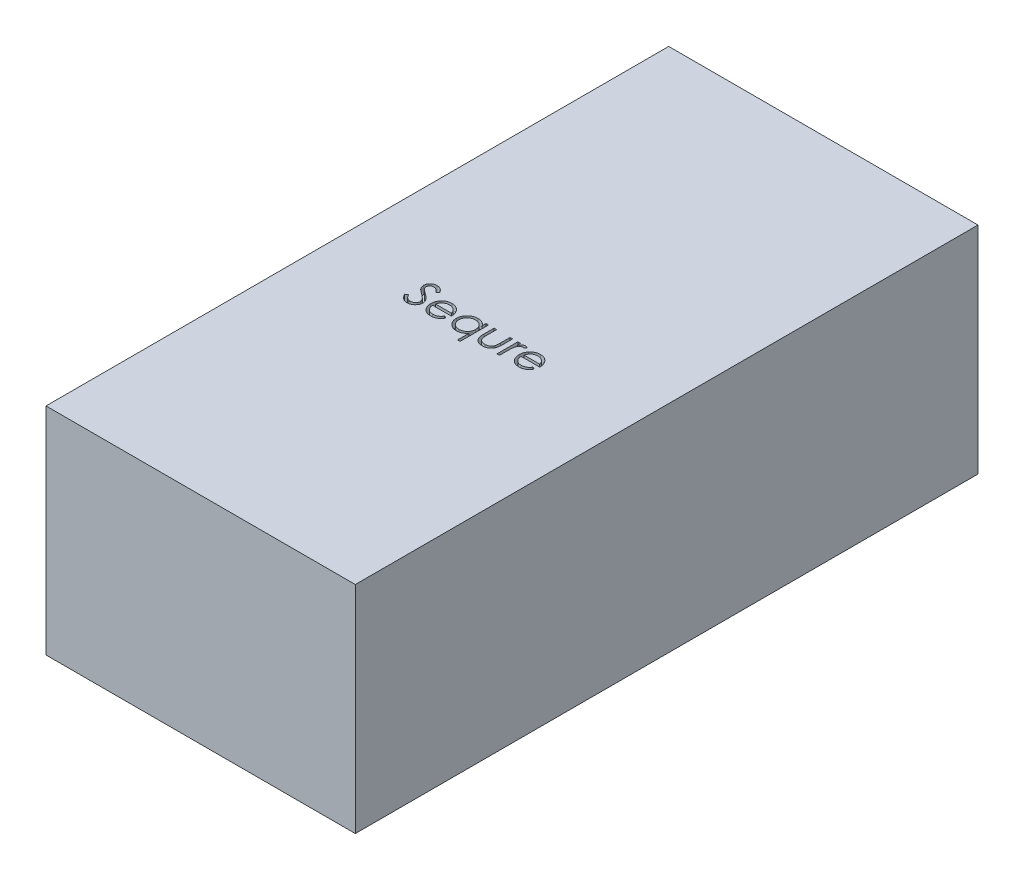
from build123d import *

# Parameters (mm, degrees)
SKETCH1_W           = 38
SKETCH1_H           = 76.5
BOSS_EXTRUDE1_DEPTH = 26.5
CUT_EXTRUDE1_DEPTH  = 1


with BuildPart() as part:
    # Sketch1 → Boss-Extrude1 (new body)
    with BuildSketch(Plane(origin=(0, 0, 0), x_dir=(1, 0, 0), z_dir=(0, 1, 0))):
        with Locations((19, 38.25)):
            Rectangle(SKETCH1_W, SKETCH1_H)
    extrude(amount=BOSS_EXTRUDE1_DEPTH)

    # Sketch2 → Cut-Extrude1 (cut)
    # profile 1 of 6: a face of its own
    with BuildSketch(Plane(origin=(0, 26.5, 0), x_dir=(1, 0, 0), z_dir=(0, 1, 0))):
        with BuildLine():
            Line((10.136770762, 33.919409506), (10.43264416, 34.09679332))
            add(Edge.make_bspline(
                [(10.43264416, 34.09679332), (10.460162397, 34.050728935), (10.512886278, 33.962471351), (10.600837637, 33.84321331), (10.691970548, 33.741851154), (10.786959881, 33.658974546), (10.885225829, 33.593725659), (10.987409883, 33.547523428), (11.093167694, 33.518707452), (11.165141515, 33.515207366), (11.201073647, 33.513459986)],
                knots=[0, 0, 0, 0, 1.272034388, 2.437168799, 3.508375237, 4.49857839, 5.41946034, 6.295179144, 7.148887113, 8, 8, 8, 8], degree=3))
            add(Edge.make_bspline(
                [(11.201073647, 33.513459986), (11.231760507, 33.514314659), (11.29259728, 33.516009049), (11.382159523, 33.532289851), (11.469141326, 33.55730198), (11.551749963, 33.593122912), (11.628845578, 33.636461397), (11.696452273, 33.688807575), (11.754898386, 33.747413781), (11.802707501, 33.812796435), (11.839387536, 33.883113584), (11.867579605, 33.955289535), (11.883224678, 34.030458103), (11.885581432, 34.081068566), (11.886770762, 34.106609025)],
                knots=[0, 0, 0, 0, 1.095163259, 2.171163733, 3.241058638, 4.321873601, 5.38011039, 6.391990106, 7.366004449, 8.327778327, 9.272591725, 10.192022065, 11.087607919, 12, 12, 12, 12], degree=3))
            add(Edge.make_bspline(
                [(11.886770762, 34.106609025), (11.885296451, 34.135749875), (11.882299393, 34.194988964), (11.856967913, 34.282388617), (11.817118666, 34.368881187), (11.780356023, 34.422382452), (11.761269961, 34.450158704)],
                knots=[0, 0, 0, 0, 0.938893495, 1.908633276, 2.914225137, 4, 4, 4, 4], degree=3))
            add(Edge.make_bspline(
                [(11.761269961, 34.450158704), (11.745599347, 34.470205528), (11.712700852, 34.512291326), (11.65614334, 34.574936562), (11.589777226, 34.639554981), (11.515873671, 34.708614038), (11.431740582, 34.778901835), (11.340013067, 34.853770112), (11.238349208, 34.93037169), (11.167049712, 34.981744255), (11.130260346, 35.008251653)],
                knots=[0, 0, 0, 0, 0.722233717, 1.516239348, 2.393582979, 3.351407094, 4.387010283, 5.505090956, 6.712668013, 8, 8, 8, 8], degree=3))
            add(Edge.make_bspline(
                [(11.130260346, 35.008251653), (11.093436349, 35.034480241), (11.023031673, 35.084627303), (10.92457309, 35.159051587), (10.836528627, 35.227095456), (10.759289611, 35.289399469), (10.692890014, 35.345972073), (10.636806603, 35.396270012), (10.592468046, 35.441653573), (10.567812465, 35.471094915), (10.556742717, 35.484313352)],
                knots=[0, 0, 0, 0, 1.452282411, 2.77665338, 3.964542531, 5.026858415, 5.96415736, 6.766646006, 7.446254459, 8, 8, 8, 8], degree=3))
            add(Edge.make_bspline(
                [(10.556742717, 35.484313352), (10.541270172, 35.504914389), (10.510841335, 35.545429092), (10.47067533, 35.60875395), (10.436536167, 35.673577216), (10.409773835, 35.74007308), (10.387237616, 35.807308009), (10.372079685, 35.876159255), (10.362588289, 35.946317873), (10.361616302, 35.993531374), (10.361129737, 36.017165916)],
                knots=[0, 0, 0, 0, 1.068054152, 2.10047183, 3.106115577, 4.101338837, 5.06977816, 6.043150881, 7.020423561, 8, 8, 8, 8], degree=3))
            add(Edge.make_bspline(
                [(10.361129737, 36.017165916), (10.362434946, 36.05419569), (10.365017466, 36.127463754), (10.386857983, 36.234494585), (10.421330877, 36.336681002), (10.469625764, 36.433011336), (10.531883117, 36.520977316), (10.603929092, 36.601590803), (10.689740578, 36.669359386), (10.783893201, 36.728571444), (10.886949573, 36.774917369), (10.994940477, 36.809878349), (11.108037549, 36.829687607), (11.184640683, 36.832530372), (11.223509544, 36.833972807)],
                knots=[0, 0, 0, 0, 1.005424448, 1.989358655, 2.955360095, 3.929531133, 4.905563448, 5.876582895, 6.856512386, 7.866279853, 8.892233794, 9.918561126, 10.94386622, 12, 12, 12, 12], degree=3))
            add(Edge.make_bspline(
                [(11.223509544, 36.833972807), (11.264753645, 36.832550255), (11.346774996, 36.829721254), (11.467424212, 36.805123723), (11.583584928, 36.764423051), (11.677028193, 36.718234393), (11.750160955, 36.672102977), (11.805933687, 36.630083153), (11.862451138, 36.581708044), (11.920169193, 36.526848798), (11.978109852, 36.465002047), (12.037133305, 36.396591358), (12.097377573, 36.322034803), (12.136133433, 36.268810302), (12.156001531, 36.24152489)],
                knots=[0, 0, 0, 0, 1.286793592, 2.559021753, 3.825965368, 5.121522368, 5.803751409, 6.523245864, 7.299691795, 8.125521123, 9.008227632, 9.944561021, 10.946284179, 12, 12, 12, 12], degree=3))
            Line((12.156001531, 36.24152489), (11.872047205, 36.026280499))
            add(Edge.make_bspline(
                [(11.872047205, 36.026280499), (11.854901272, 36.04836919), (11.821882215, 36.090906843), (11.771752728, 36.150478158), (11.72450408, 36.204894638), (11.67795368, 36.252159766), (11.634560049, 36.294861899), (11.592443007, 36.331421656), (11.552208655, 36.362197252), (11.501491745, 36.395040812), (11.437774026, 36.427597315), (11.35778949, 36.455146393), (11.274203215, 36.471701455), (11.217273584, 36.473890343), (11.188453455, 36.474998448)],
                knots=[0, 0, 0, 0, 1.181633172, 2.275549214, 3.290209073, 4.226197932, 5.078386478, 5.862611352, 6.581680152, 7.217281963, 8.414376989, 9.595101626, 10.782541182, 12, 12, 12, 12], degree=3))
            add(Edge.make_bspline(
                [(11.188453455, 36.474998448), (11.152296932, 36.473786748), (11.082572485, 36.471450099), (10.983582249, 36.445930113), (10.894488324, 36.405748253), (10.817935758, 36.349433275), (10.754198781, 36.282712282), (10.708093323, 36.205933427), (10.680343158, 36.121151025), (10.676956878, 36.062009368), (10.675232301, 36.031889474)],
                knots=[0, 0, 0, 0, 1.14458467, 2.207223713, 3.21896685, 4.227309161, 5.202851033, 6.127160689, 7.046193047, 8, 8, 8, 8], degree=3))
            add(Edge.make_bspline(
                [(10.675232301, 36.031889474), (10.675625427, 36.013137995), (10.676412323, 35.975604376), (10.687387121, 35.920152954), (10.70148645, 35.864841614), (10.723829082, 35.809919031), (10.754674385, 35.754424672), (10.795179561, 35.697402935), (10.846192873, 35.638351226), (10.885269886, 35.599943852), (10.905901371, 35.579665916)],
                knots=[0, 0, 0, 0, 0.858281714, 1.717966888, 2.583508476, 3.4729293, 4.427298488, 5.488583878, 6.674047936, 8, 8, 8, 8], degree=3))
            add(Edge.make_bspline(
                [(10.905901371, 35.579665916), (10.913562744, 35.57282889), (10.931764411, 35.556585682), (10.965040336, 35.529993401), (11.008983135, 35.497190629), (11.062445336, 35.456603312), (11.126412698, 35.40952185), (11.200892254, 35.356548238), (11.285053787, 35.295962779), (11.344775702, 35.253605238), (11.376354096, 35.231208384)],
                knots=[0, 0, 0, 0, 0.420754252, 0.999615792, 1.744751191, 2.668019286, 3.750313428, 4.999500688, 6.413464383, 8, 8, 8, 8], degree=3))
            add(Edge.make_bspline(
                [(11.376354096, 35.231208384), (11.414340009, 35.203567024), (11.487894465, 35.150043362), (11.592552045, 35.069627682), (11.687445853, 34.990979914), (11.772909057, 34.914602307), (11.849785965, 34.841074214), (11.917223686, 34.769511033), (11.975909366, 34.700425461), (12.039088585, 34.611852885), (12.103646404, 34.503071801), (12.159087912, 34.369793562), (12.194046259, 34.235997242), (12.198617775, 34.146070405), (12.200873326, 34.101701172)],
                knots=[0, 0, 0, 0, 1.163667725, 2.253281268, 3.268753668, 4.215851969, 5.092017293, 5.902905408, 6.650798638, 7.335211899, 8.59617414, 9.77448103, 10.901945474, 12, 12, 12, 12], degree=3))
            add(Edge.make_bspline(
                [(12.200873326, 34.101701172), (12.200216188, 34.070322807), (12.198914673, 34.008175424), (12.183953759, 33.916920347), (12.162034094, 33.828289477), (12.12899686, 33.743378365), (12.088673702, 33.660633602), (12.037507454, 33.582225701), (11.978199769, 33.506419303), (11.910166004, 33.435235812), (11.835720102, 33.369889616), (11.757036407, 33.311760554), (11.673986135, 33.263292231), (11.587019818, 33.223741389), (11.496117481, 33.192807871), (11.401309697, 33.170395002), (11.302440186, 33.156639291), (11.235239705, 33.15521153), (11.201073647, 33.154485627)],
                knots=[0, 0, 0, 0, 0.983748083, 1.948392443, 2.894712957, 3.844097841, 4.80183111, 5.778335162, 6.776009319, 7.81870978, 8.863265674, 9.881300176, 10.883814829, 11.87499822, 12.874611388, 13.892143829, 14.928324115, 16, 16, 16, 16], degree=3))
            add(Edge.make_bspline(
                [(11.201073647, 33.154485627), (11.174638304, 33.154996809), (11.122100544, 33.156012734), (11.044391062, 33.164994015), (10.968251473, 33.177701118), (10.894637191, 33.197875188), (10.822599779, 33.222352165), (10.752452545, 33.252490498), (10.684161491, 33.288607699), (10.617343908, 33.329902724), (10.552169733, 33.377960469), (10.489250265, 33.433933965), (10.42652108, 33.49627947), (10.365833683, 33.566690033), (10.305960539, 33.644028116), (10.24808213, 33.7290173), (10.191000412, 33.821194653), (10.155184944, 33.886059739), (10.136770762, 33.919409506)],
                knots=[0, 0, 0, 0, 0.915332311, 1.819136955, 2.706846663, 3.586547465, 4.459518054, 5.340707479, 6.227863349, 7.133153174, 8.059268498, 9.028702269, 10.047606654, 11.120612155, 12.245963614, 13.433783089, 14.680604001, 16, 16, 16, 16], degree=3))
        make_face()
    # profile 2 of 6: a face of its own
    with BuildSketch(Plane(origin=(0, 26.5, 0), x_dir=(1, 0, 0), z_dir=(0, 1, 0))):
        with BuildLine():
            Line((14.928237108, 34.051921525), (15.207283583, 33.90538707))
            add(Edge.make_bspline(
                [(15.207283583, 33.90538707), (15.185046987, 33.865943738), (15.141783379, 33.789202636), (15.067382631, 33.683770775), (14.989390559, 33.588923059), (14.904286591, 33.507193405), (14.814616912, 33.43594202), (14.719884257, 33.373604195), (14.619595439, 33.320485675), (14.513745714, 33.275733147), (14.401446163, 33.241323653), (14.282424647, 33.217019432), (14.156453151, 33.201996163), (14.070106971, 33.200251023), (14.025893358, 33.199357422)],
                knots=[0, 0, 0, 0, 1.120438281, 2.179929193, 3.190490725, 4.156257408, 5.095198341, 6.022838206, 6.959905092, 7.901321166, 8.864066838, 9.862729781, 10.905609505, 12, 12, 12, 12], degree=3))
            add(Edge.make_bspline(
                [(14.025893358, 33.199357422), (13.976751381, 33.200504598), (13.880889619, 33.202742404), (13.741349872, 33.222034869), (13.609970454, 33.253507227), (13.48675875, 33.297472769), (13.372016498, 33.354900093), (13.265515643, 33.424859575), (13.166696117, 33.506991829), (13.078671908, 33.602008273), (12.999428025, 33.70369023), (12.929502205, 33.809646115), (12.871044774, 33.919609339), (12.823492164, 34.032879863), (12.785087299, 34.148743757), (12.758320595, 34.268255224), (12.742890847, 34.391090809), (12.740526402, 34.474188144), (12.739334865, 34.516064153)],
                knots=[0, 0, 0, 0, 1.145258523, 2.234067595, 3.276747158, 4.290159414, 5.277019952, 6.260822364, 7.254936242, 8.264827045, 9.274100331, 10.257902744, 11.220704747, 12.172965371, 13.118907548, 14.062713208, 15.023725156, 16, 16, 16, 16], degree=3))
            add(Edge.make_bspline(
                [(12.739334865, 34.516064153), (12.740394006, 34.555358983), (12.742493084, 34.633236148), (12.755723872, 34.748501693), (12.779172165, 34.860530145), (12.811348489, 34.969414593), (12.852899735, 35.074972727), (12.903731954, 35.177268791), (12.963924332, 35.276193931), (13.010397006, 35.338597064), (13.033806019, 35.370030499)],
                knots=[0, 0, 0, 0, 1.024358464, 2.0301432, 3.019427413, 4.004406732, 4.986367066, 5.972626655, 6.978780325, 8, 8, 8, 8], degree=3))
            add(Edge.make_bspline(
                [(13.033806019, 35.370030499), (13.065513701, 35.407899369), (13.127924648, 35.48243752), (13.233481003, 35.580375845), (13.3477812, 35.662419621), (13.469392826, 35.730426757), (13.5997293, 35.782100404), (13.737038591, 35.820607986), (13.882884177, 35.842185997), (13.982589398, 35.845233831), (14.033605698, 35.84679332)],
                knots=[0, 0, 0, 0, 1.030682036, 2.02871468, 2.997146059, 3.962720338, 4.930598197, 5.918074684, 6.934738563, 8, 8, 8, 8], degree=3))
            add(Edge.make_bspline(
                [(14.033605698, 35.84679332), (14.086053303, 35.845439271), (14.188943549, 35.842782936), (14.33897567, 35.818156602), (14.480936387, 35.779104048), (14.614768891, 35.723950257), (14.740486752, 35.652790705), (14.857272802, 35.564648864), (14.967124314, 35.462230777), (15.031032893, 35.383467567), (15.063553615, 35.343387871)],
                knots=[0, 0, 0, 0, 1.056321875, 2.072262726, 3.055038591, 4.01806755, 4.982017516, 5.957941055, 6.960871419, 8, 8, 8, 8], degree=3))
            add(Edge.make_bspline(
                [(15.063553615, 35.343387871), (15.085680553, 35.31318429), (15.129787146, 35.252978171), (15.185034246, 35.154807014), (15.232991641, 35.052096419), (15.271324602, 34.943186122), (15.302364103, 34.829366542), (15.324820922, 34.709823997), (15.337990541, 34.584594086), (15.340579238, 34.499267531), (15.341898967, 34.455767679)],
                knots=[0, 0, 0, 0, 0.94817472, 1.890038105, 2.849395472, 3.817997239, 4.812318967, 5.836947057, 6.897266129, 8, 8, 8, 8], degree=3))
            Line((15.341898967, 34.455767679), (13.053437429, 34.455767679))
            add(Edge.make_bspline(
                [(13.053437429, 34.455767679), (13.054977035, 34.422067214), (13.058004609, 34.355796611), (13.072119752, 34.258825828), (13.094368526, 34.166452485), (13.125637589, 34.079369443), (13.163504434, 33.996439316), (13.209890151, 33.918277279), (13.265229705, 33.845239349), (13.326955404, 33.776672211), (13.3956625, 33.71561145), (13.467945247, 33.660959674), (13.544838812, 33.615154077), (13.625736895, 33.577974187), (13.71050868, 33.548867871), (13.799180875, 33.529000051), (13.891578992, 33.515692944), (13.954564726, 33.514213279), (13.986630538, 33.513459986)],
                knots=[0, 0, 0, 0, 1.094153842, 2.151609401, 3.174256925, 4.172055639, 5.149267565, 6.128595816, 7.11444997, 8.118368179, 9.117203808, 10.09244225, 11.054858984, 12.015122123, 12.976791628, 13.957293641, 14.960065497, 16, 16, 16, 16], degree=3))
            add(Edge.make_bspline(
                [(13.986630538, 33.513459986), (14.017981685, 33.514068043), (14.080188376, 33.515274544), (14.172829234, 33.527006455), (14.263968761, 33.545976731), (14.353229744, 33.571866721), (14.43880059, 33.603443573), (14.51804614, 33.64154643), (14.590926356, 33.683696177), (14.659043323, 33.731905852), (14.725114316, 33.790914039), (14.790656802, 33.86454976), (14.860933456, 33.951637288), (14.904923048, 34.017182954), (14.928237108, 34.051921525)],
                knots=[0, 0, 0, 0, 0.99110716, 1.966546729, 2.947904876, 3.932708344, 4.903319531, 5.828989031, 6.710028674, 7.56322171, 8.463672341, 9.504779593, 10.677557249, 12, 12, 12, 12], degree=3))
        make_face()
        with BuildLine():
            add(Edge.make_bspline(
                [(15.027796403, 34.769870243), (15.016299779, 34.811533116), (14.994172477, 34.891720737), (14.947936113, 35.002761627), (14.895864572, 35.101449529), (14.834242841, 35.187029162), (14.764424115, 35.263032675), (14.683778932, 35.32945126), (14.593343039, 35.388868711), (14.493583898, 35.43902121), (14.387942113, 35.481711069), (14.277335921, 35.510336185), (14.164478133, 35.529945727), (14.088143847, 35.531771835), (14.049731499, 35.532690756)],
                knots=[0, 0, 0, 0, 1.154881502, 2.222775134, 3.210006277, 4.132804581, 5.035138423, 5.962687519, 6.919655026, 7.923214229, 8.944639381, 9.960483929, 10.97369054, 12, 12, 12, 12], degree=3))
            add(Edge.make_bspline(
                [(14.049731499, 35.532690756), (14.018382061, 35.532079084), (13.956410812, 35.530869938), (13.865109744, 35.519399809), (13.777430045, 35.500439964), (13.692724757, 35.474475007), (13.612103889, 35.439866405), (13.53390912, 35.399283178), (13.460128724, 35.349741594), (13.413987429, 35.311982739), (13.390677012, 35.292907102)],
                knots=[0, 0, 0, 0, 1.04873581, 2.073130211, 3.073294108, 4.04793562, 5.032784715, 6.005352987, 6.992311501, 8, 8, 8, 8], degree=3))
            add(Edge.make_bspline(
                [(13.390677012, 35.292907102), (13.37398373, 35.277812786), (13.340200596, 35.24726557), (13.295060075, 35.194636363), (13.251839602, 35.137884801), (13.212505949, 35.074839677), (13.176428363, 35.006218898), (13.142668385, 34.932601262), (13.112281973, 34.853428132), (13.095185863, 34.798255693), (13.086390153, 34.769870243)],
                knots=[0, 0, 0, 0, 0.879870761, 1.780643979, 2.707998968, 3.669668524, 4.684282772, 5.740141944, 6.837334558, 8, 8, 8, 8], degree=3))
            Line((13.086390153, 34.769870243), (15.027796403, 34.769870243))
        make_face(mode=Mode.SUBTRACT)
    # profile 3 of 6: a face of its own
    with BuildSketch(Plane(origin=(0, 26.5, 0), x_dir=(1, 0, 0), z_dir=(0, 1, 0))):
        with BuildLine():
            Line((18.572668198, 35.801921525), (18.572668198, 32.301921525))
            Line((18.572668198, 32.301921525), (18.258565634, 32.301921525))
            Line((18.258565634, 32.301921525), (18.258565634, 33.707670724))
            add(Edge.make_bspline(
                [(18.258565634, 33.707670724), (18.223095564, 33.667451456), (18.153674588, 33.588735492), (18.038304491, 33.484713633), (17.916226564, 33.396811022), (17.787533526, 33.324727284), (17.653206558, 33.267844215), (17.511915761, 33.229135283), (17.365121867, 33.20320829), (17.264721993, 33.200651704), (17.21389416, 33.199357422)],
                knots=[0, 0, 0, 0, 1.069893489, 2.093963999, 3.093541679, 4.066938296, 5.033073547, 5.99758523, 6.986269586, 8, 8, 8, 8], degree=3))
            add(Edge.make_bspline(
                [(17.21389416, 33.199357422), (17.168726206, 33.200583795), (17.079653001, 33.203002255), (16.948623924, 33.221764559), (16.822531674, 33.25189518), (16.701257102, 33.29379607), (16.585584956, 33.349376891), (16.47452486, 33.415918139), (16.368652168, 33.495158969), (16.269580629, 33.585746998), (16.178348628, 33.684141985), (16.098287356, 33.789087532), (16.031534276, 33.900129836), (15.975714195, 34.01586299), (15.932717851, 34.137177909), (15.902744216, 34.263655077), (15.88400377, 34.395144951), (15.881586309, 34.484684474), (15.880360506, 34.530086589)],
                knots=[0, 0, 0, 0, 1.033919861, 2.038935746, 3.024066025, 3.998881131, 4.97069526, 5.957263378, 6.95902576, 7.993208707, 9.027059324, 10.027763471, 11.009749337, 11.988697705, 12.965288445, 13.950418724, 14.960734635, 16, 16, 16, 16], degree=3))
            add(Edge.make_bspline(
                [(15.880360506, 34.530086589), (15.881613477, 34.574550292), (15.884090534, 34.662452636), (15.902543754, 34.791731334), (15.933574763, 34.916249595), (15.97712261, 35.035606538), (16.032964565, 35.149946588), (16.100892652, 35.259350613), (16.180911777, 35.36412001), (16.273164184, 35.461791237), (16.373098954, 35.552011851), (16.480007685, 35.630420897), (16.591230966, 35.698137746), (16.708493977, 35.751791222), (16.830061082, 35.795200327), (16.957014527, 35.825233295), (17.088826106, 35.842930616), (17.178316598, 35.84549338), (17.223709865, 35.84679332)],
                knots=[0, 0, 0, 0, 1.020392517, 2.01726096, 2.990465484, 3.961182959, 4.928053699, 5.906110375, 6.912531644, 7.948652711, 8.985773172, 9.998621852, 10.987621588, 11.969261332, 12.953316658, 13.946091881, 14.958173133, 16, 16, 16, 16], degree=3))
            add(Edge.make_bspline(
                [(17.223709865, 35.84679332), (17.275909724, 35.845355568), (17.378271184, 35.842536205), (17.527999193, 35.819073478), (17.669643671, 35.779435011), (17.804298023, 35.725517513), (17.931478709, 35.653868784), (18.049981693, 35.563488823), (18.161047177, 35.454947636), (18.225427468, 35.371577191), (18.258565634, 35.328664313)],
                knots=[0, 0, 0, 0, 1.038897134, 2.037228247, 3.008116434, 3.962042015, 4.918381754, 5.904844433, 6.921570401, 8, 8, 8, 8], degree=3))
            Line((18.258565634, 35.328664313), (18.258565634, 35.801921525))
            Line((18.258565634, 35.801921525), (18.572668198, 35.801921525))
        make_face()
        with BuildLine():
            add(Edge.make_bspline(
                [(17.227916596, 35.532690756), (17.182002258, 35.531057118), (17.091374658, 35.527832577), (16.958330656, 35.502659082), (16.831017242, 35.460774487), (16.710071167, 35.403492586), (16.597402951, 35.331463849), (16.49670928, 35.244342466), (16.407166578, 35.144505452), (16.331858314, 35.032403342), (16.270467817, 34.912225251), (16.227300785, 34.786600812), (16.198831538, 34.657795835), (16.195923017, 34.570433149), (16.19446307, 34.52658098)],
                knots=[0, 0, 0, 0, 1.031046209, 2.035121221, 3.029706178, 4.034933723, 5.034054252, 6.02443088, 7.017295772, 8.038157696, 9.050218397, 10.03989886, 11.016116709, 12, 12, 12, 12], degree=3))
            add(Edge.make_bspline(
                [(16.19446307, 34.52658098), (16.196327963, 34.482990873), (16.20005044, 34.395981517), (16.226801134, 34.26700094), (16.271681008, 34.141346898), (16.332923071, 34.020085905), (16.409609695, 33.907501804), (16.498498348, 33.805761682), (16.600448629, 33.718272093), (16.713376136, 33.64503452), (16.833984107, 33.585871999), (16.960818038, 33.544706359), (17.091493676, 33.518128579), (17.18034601, 33.515024102), (17.225112108, 33.513459986)],
                knots=[0, 0, 0, 0, 0.979072187, 1.954306742, 2.945804271, 3.96968567, 4.997920485, 5.998718438, 6.996577872, 8.005894225, 9.015743152, 10.005417472, 10.995077863, 12, 12, 12, 12], degree=3))
            add(Edge.make_bspline(
                [(17.225112108, 33.513459986), (17.270558611, 33.51511995), (17.360947198, 33.518421454), (17.494385906, 33.543702719), (17.623880868, 33.585471518), (17.747668097, 33.643370644), (17.862984228, 33.715128), (17.966482105, 33.799135091), (18.053998074, 33.896838275), (18.128190683, 34.004214728), (18.1863661, 34.121926725), (18.228742159, 34.247260916), (18.253796065, 34.380221664), (18.256953795, 34.471085591), (18.258565634, 34.517466397)],
                knots=[0, 0, 0, 0, 1.01762866, 2.023962475, 3.030623092, 4.058876274, 5.077231937, 6.066672613, 7.034107872, 8.005628644, 8.981990164, 9.965428785, 10.961468474, 12, 12, 12, 12], degree=3))
            add(Edge.make_bspline(
                [(18.258565634, 34.517466397), (18.257605978, 34.552804227), (18.25571707, 34.62236026), (18.241286501, 34.724487778), (18.218331574, 34.822221504), (18.185985404, 34.915664193), (18.14349412, 35.004299209), (18.092246354, 35.088762969), (18.031340904, 35.16861618), (17.961758208, 35.242759251), (17.885593006, 35.310385713), (17.804998465, 35.370749954), (17.719019718, 35.420338727), (17.629102681, 35.461379998), (17.535091347, 35.494039148), (17.436220727, 35.515826842), (17.33354174, 35.530787163), (17.263495684, 35.532049544), (17.227916596, 35.532690756)],
                knots=[0, 0, 0, 0, 1.050140795, 2.067009409, 3.05949893, 4.030605086, 5.00011959, 5.97591094, 6.962425594, 7.979863591, 8.993523472, 9.986985069, 10.967611495, 11.937549037, 12.921786183, 13.919465291, 14.943216303, 16, 16, 16, 16], degree=3))
        make_face(mode=Mode.SUBTRACT)
    # profile 4 of 6: a face of its own
    with BuildSketch(Plane(origin=(0, 26.5, 0), x_dir=(1, 0, 0), z_dir=(0, 1, 0))):
        with BuildLine():
            Line((19.245745121, 35.801921525), (19.559847685, 35.801921525))
            Line((19.559847685, 35.801921525), (19.559847685, 34.615623448))
            add(Edge.make_bspline(
                [(19.559847685, 34.615623448), (19.55998959, 34.580800699), (19.560261048, 34.514186411), (19.562101989, 34.418331224), (19.566432082, 34.330914511), (19.571845907, 34.251885774), (19.578808043, 34.181258383), (19.587091403, 34.119279026), (19.596349825, 34.065244842), (19.605412539, 34.032701486), (19.609627333, 34.017566557)],
                knots=[0, 0, 0, 0, 1.388932606, 2.656963016, 3.823490214, 4.879454478, 5.816252168, 6.653371382, 7.373723809, 8, 8, 8, 8], degree=3))
            add(Edge.make_bspline(
                [(19.609627333, 34.017566557), (19.616388788, 33.998543686), (19.629771129, 33.960893425), (19.654044612, 33.90650442), (19.684072949, 33.856129137), (19.716932777, 33.807825064), (19.754832185, 33.763023078), (19.797291656, 33.721798834), (19.842889893, 33.682594743), (19.910644916, 33.636209951), (20.003304182, 33.586494621), (20.124956937, 33.543598802), (20.256861163, 33.517962982), (20.348025883, 33.514988727), (20.394883743, 33.513459986)],
                knots=[0, 0, 0, 0, 0.725840625, 1.436591201, 2.137033971, 2.831655856, 3.53531722, 4.242432219, 4.957935707, 5.694543706, 7.190802206, 8.724350549, 10.316345118, 12, 12, 12, 12], degree=3))
            add(Edge.make_bspline(
                [(20.394883743, 33.513459986), (20.441737251, 33.515021235), (20.532390119, 33.518041962), (20.662845088, 33.542825501), (20.782096503, 33.58423119), (20.888947454, 33.642038602), (20.982913294, 33.712780664), (21.061217713, 33.795789473), (21.125824967, 33.88843886), (21.154034388, 33.957563139), (21.168221083, 33.992326172)],
                knots=[0, 0, 0, 0, 1.157059328, 2.238695713, 3.266970494, 4.264342957, 5.228770407, 6.160125903, 7.074715775, 8, 8, 8, 8], degree=3))
            add(Edge.make_bspline(
                [(21.168221083, 33.992326172), (21.172415313, 34.006292471), (21.181687731, 34.037168546), (21.191650083, 34.089548295), (21.200624544, 34.152012899), (21.20828772, 34.224971108), (21.213752883, 34.30823226), (21.21669891, 34.401770337), (21.220027185, 34.505291697), (21.220077701, 34.577759456), (21.220104096, 34.615623448)],
                knots=[0, 0, 0, 0, 0.557542046, 1.232589297, 2.036731608, 2.971723315, 4.038036528, 5.22795436, 6.551621927, 8, 8, 8, 8], degree=3))
            Line((21.220104096, 34.615623448), (21.220104096, 35.801921525))
            Line((21.220104096, 35.801921525), (21.53420666, 35.801921525))
            Line((21.53420666, 35.801921525), (21.53420666, 34.556729217))
            add(Edge.make_bspline(
                [(21.53420666, 34.556729217), (21.533764965, 34.514422046), (21.532908016, 34.432340346), (21.527400673, 34.313056234), (21.51795106, 34.201893989), (21.503608375, 34.09879477), (21.486742701, 34.003837288), (21.464986428, 33.916899842), (21.43900819, 33.838250288), (21.409702675, 33.766508511), (21.375080808, 33.701461617), (21.338253787, 33.6397258), (21.295729015, 33.582832865), (21.250958781, 33.527950728), (21.201157125, 33.4778092), (21.147257266, 33.431257725), (21.090017846, 33.387584693), (21.028168648, 33.348493413), (20.962612585, 33.313276768), (20.893268728, 33.28206069), (20.81928773, 33.257358113), (20.741624093, 33.236047447), (20.659897314, 33.219332978), (20.574186181, 33.207546411), (20.484519564, 33.20032108), (20.423410105, 33.199684035), (20.392079256, 33.199357422)],
                knots=[0, 0, 0, 0, 1.493040784, 2.896703357, 4.213163133, 5.428574705, 6.569057535, 7.615249723, 8.588095153, 9.490268104, 10.346124644, 11.18633936, 12.024365274, 12.850166724, 13.684164916, 14.514361689, 15.362232829, 16.222528818, 17.093394965, 17.986930858, 18.902426812, 19.842810585, 20.827885679, 21.843828298, 22.894529745, 24, 24, 24, 24], degree=3))
            add(Edge.make_bspline(
                [(20.392079256, 33.199357422), (20.360982742, 33.199697129), (20.299875197, 33.200364686), (20.210203952, 33.207506493), (20.124255346, 33.219314664), (20.042334948, 33.236169881), (19.96436055, 33.257208951), (19.89001631, 33.282212487), (19.820172747, 33.313292968), (19.753990743, 33.348270526), (19.691988355, 33.387835801), (19.633879777, 33.431203841), (19.579742925, 33.478309904), (19.529565857, 33.528957261), (19.48405288, 33.583774198), (19.442636838, 33.642319758), (19.404680133, 33.704013846), (19.370327343, 33.770077009), (19.340815587, 33.842649019), (19.314760341, 33.922946116), (19.293449703, 34.011848633), (19.276107235, 34.109280561), (19.262155794, 34.214775603), (19.252469652, 34.328944018), (19.247053821, 34.45150771), (19.24619076, 34.5361576), (19.245745121, 34.579866236)],
                knots=[0, 0, 0, 0, 1.083640291, 2.129454052, 3.13281866, 4.105697902, 5.042300162, 5.946461698, 6.836384745, 7.703652036, 8.553297018, 9.397182691, 10.228592656, 11.052265423, 11.879314572, 12.708807002, 13.549817954, 14.402308542, 15.300838682, 16.27712199, 17.341985831, 18.484375296, 19.725102775, 21.0496083, 22.476576903, 24, 24, 24, 24], degree=3))
            Line((19.245745121, 34.579866236), (19.245745121, 35.801921525))
        make_face()
    # profile 5 of 6: a face of its own
    with BuildSketch(Plane(origin=(0, 26.5, 0), x_dir=(1, 0, 0), z_dir=(0, 1, 0))):
        with BuildLine():
            Line((22.162411788, 35.801921525), (22.476514352, 35.801921525))
            Line((22.476514352, 35.801921525), (22.476514352, 35.425419121))
            add(Edge.make_bspline(
                [(22.476514352, 35.425419121), (22.499703111, 35.460474949), (22.544051432, 35.527518949), (22.617764361, 35.61618825), (22.693267692, 35.689603296), (22.77092288, 35.748106815), (22.851300979, 35.791919934), (22.932637931, 35.824012969), (23.016213401, 35.842990284), (23.072375325, 35.845523943), (23.100512749, 35.84679332)],
                knots=[0, 0, 0, 0, 1.2804753, 2.448899062, 3.506932113, 4.484331642, 5.4025378, 6.288909075, 7.142734305, 8, 8, 8, 8], degree=3))
            add(Edge.make_bspline(
                [(23.100512749, 35.84679332), (23.122339076, 35.845602793), (23.167248161, 35.843153207), (23.235230751, 35.825942383), (23.305274203, 35.79846436), (23.35041659, 35.772624137), (23.373950249, 35.759153095)],
                knots=[0, 0, 0, 0, 0.901110191, 1.854092781, 2.881294221, 4, 4, 4, 4], degree=3))
            Line((23.373950249, 35.759153095), (23.201474288, 35.487117839))
            add(Edge.make_bspline(
                [(23.201474288, 35.487117839), (23.186365267, 35.493858105), (23.157685452, 35.50665242), (23.115730886, 35.521794431), (23.077049549, 35.530710346), (23.052405991, 35.532061064), (23.040917397, 35.532690756)],
                knots=[0, 0, 0, 0, 1.180555205, 2.24091978, 3.179933427, 4, 4, 4, 4], degree=3))
            add(Edge.make_bspline(
                [(23.040917397, 35.532690756), (23.015711663, 35.531010718), (22.964299273, 35.527583929), (22.888814774, 35.500645121), (22.815567568, 35.457119881), (22.757395906, 35.408848769), (22.712353653, 35.362300972), (22.680213428, 35.321652569), (22.650730681, 35.276073938), (22.62256046, 35.226344254), (22.596894166, 35.171614408), (22.572939497, 35.112431194), (22.551280634, 35.048726066), (22.53893039, 35.004343545), (22.532604096, 34.981609025)],
                knots=[0, 0, 0, 0, 1.125678352, 2.296057538, 3.5422874, 4.923748041, 5.663163013, 6.437101912, 7.23742474, 8.08941207, 8.991984279, 9.93940061, 10.944477711, 12, 12, 12, 12], degree=3))
            add(Edge.make_bspline(
                [(22.532604096, 34.981609025), (22.527871702, 34.961331851), (22.51738981, 34.916419453), (22.507198273, 34.841070928), (22.497128755, 34.752047269), (22.490032136, 34.649100676), (22.483454094, 34.532488232), (22.479744012, 34.402032287), (22.476640871, 34.257598936), (22.476557805, 34.156624582), (22.476514352, 34.103804538)],
                knots=[0, 0, 0, 0, 0.566838948, 1.255505196, 2.06880316, 3.007127437, 4.065329342, 5.249902469, 6.561414163, 8, 8, 8, 8], degree=3))
            Line((22.476514352, 34.103804538), (22.476514352, 33.244229217))
            Line((22.476514352, 33.244229217), (22.162411788, 33.244229217))
            Line((22.162411788, 33.244229217), (22.162411788, 35.801921525))
        make_face()
    # profile 6 of 6: a face of its own
    with BuildSketch(Plane(origin=(0, 26.5, 0), x_dir=(1, 0, 0), z_dir=(0, 1, 0))):
        with BuildLine():
            Line((25.787211467, 34.051921525), (26.066257942, 33.90538707))
            add(Edge.make_bspline(
                [(26.066257942, 33.90538707), (26.044021346, 33.865943738), (26.000757738, 33.789202636), (25.92635699, 33.683770775), (25.848364917, 33.588923059), (25.763260949, 33.507193405), (25.673591271, 33.43594202), (25.578858616, 33.373604195), (25.478569798, 33.320485675), (25.372720073, 33.275733147), (25.260420522, 33.241323653), (25.141399006, 33.217019432), (25.01542751, 33.201996163), (24.92908133, 33.200251023), (24.884867717, 33.199357422)],
                knots=[0, 0, 0, 0, 1.120438281, 2.179929193, 3.190490725, 4.156257408, 5.095198341, 6.022838206, 6.959905092, 7.901321166, 8.864066838, 9.862729781, 10.905609505, 12, 12, 12, 12], degree=3))
            add(Edge.make_bspline(
                [(24.884867717, 33.199357422), (24.83572574, 33.200504598), (24.739863978, 33.202742404), (24.600324231, 33.222034869), (24.468944813, 33.253507227), (24.345733109, 33.297472769), (24.230990857, 33.354900093), (24.124490002, 33.424859575), (24.025670476, 33.506991829), (23.937646267, 33.602008273), (23.858402384, 33.70369023), (23.788476564, 33.809646115), (23.730019133, 33.919609339), (23.682466523, 34.032879863), (23.644061658, 34.148743757), (23.617294954, 34.268255224), (23.601865206, 34.391090809), (23.599500761, 34.474188144), (23.598309224, 34.516064153)],
                knots=[0, 0, 0, 0, 1.145258523, 2.234067595, 3.276747158, 4.290159414, 5.277019952, 6.260822364, 7.254936242, 8.264827045, 9.274100331, 10.257902744, 11.220704747, 12.172965371, 13.118907548, 14.062713208, 15.023725156, 16, 16, 16, 16], degree=3))
            add(Edge.make_bspline(
                [(23.598309224, 34.516064153), (23.599368365, 34.555358983), (23.601467443, 34.633236148), (23.614698231, 34.748501693), (23.638146524, 34.860530145), (23.670322848, 34.969414593), (23.711874094, 35.074972727), (23.762706313, 35.177268791), (23.822898691, 35.276193931), (23.869371365, 35.338597064), (23.892780378, 35.370030499)],
                knots=[0, 0, 0, 0, 1.024358464, 2.0301432, 3.019427413, 4.004406732, 4.986367066, 5.972626655, 6.978780325, 8, 8, 8, 8], degree=3))
            add(Edge.make_bspline(
                [(23.892780378, 35.370030499), (23.92448806, 35.407899369), (23.986899007, 35.48243752), (24.092455362, 35.580375845), (24.206755559, 35.662419621), (24.328367185, 35.730426757), (24.458703659, 35.782100404), (24.59601295, 35.820607986), (24.741858536, 35.842185997), (24.841563757, 35.845233831), (24.892580057, 35.84679332)],
                knots=[0, 0, 0, 0, 1.030682036, 2.02871468, 2.997146059, 3.962720338, 4.930598197, 5.918074684, 6.934738563, 8, 8, 8, 8], degree=3))
            add(Edge.make_bspline(
                [(24.892580057, 35.84679332), (24.945027662, 35.845439271), (25.047917908, 35.842782936), (25.197950029, 35.818156602), (25.339910746, 35.779104048), (25.47374325, 35.723950257), (25.599461111, 35.652790705), (25.716247161, 35.564648864), (25.826098673, 35.462230777), (25.890007252, 35.383467567), (25.922527974, 35.343387871)],
                knots=[0, 0, 0, 0, 1.056321875, 2.072262726, 3.055038591, 4.01806755, 4.982017516, 5.957941055, 6.960871419, 8, 8, 8, 8], degree=3))
            add(Edge.make_bspline(
                [(25.922527974, 35.343387871), (25.944654912, 35.31318429), (25.988761505, 35.252978171), (26.044008605, 35.154807014), (26.091966, 35.052096419), (26.130298961, 34.943186122), (26.161338462, 34.829366542), (26.183795281, 34.709823997), (26.1969649, 34.584594086), (26.199553597, 34.499267531), (26.200873326, 34.455767679)],
                knots=[0, 0, 0, 0, 0.94817472, 1.890038105, 2.849395472, 3.817997239, 4.812318967, 5.836947057, 6.897266129, 8, 8, 8, 8], degree=3))
            Line((26.200873326, 34.455767679), (23.912411788, 34.455767679))
            add(Edge.make_bspline(
                [(23.912411788, 34.455767679), (23.913951394, 34.422067214), (23.916978968, 34.355796611), (23.931094111, 34.258825828), (23.953342885, 34.166452485), (23.984611948, 34.079369443), (24.022478793, 33.996439316), (24.06886451, 33.918277279), (24.124204064, 33.845239349), (24.185929763, 33.776672211), (24.254636859, 33.71561145), (24.326919606, 33.660959674), (24.403813171, 33.615154077), (24.484711254, 33.577974187), (24.569483039, 33.548867871), (24.658155234, 33.529000051), (24.750553351, 33.515692944), (24.813539085, 33.514213279), (24.845604897, 33.513459986)],
                knots=[0, 0, 0, 0, 1.094153842, 2.151609401, 3.174256925, 4.172055639, 5.149267565, 6.128595816, 7.11444997, 8.118368179, 9.117203808, 10.09244225, 11.054858984, 12.015122123, 12.976791628, 13.957293641, 14.960065497, 16, 16, 16, 16], degree=3))
            add(Edge.make_bspline(
                [(24.845604897, 33.513459986), (24.876956044, 33.514068043), (24.939162735, 33.515274544), (25.031803593, 33.527006455), (25.12294312, 33.545976731), (25.212204103, 33.571866721), (25.297774949, 33.603443573), (25.377020499, 33.64154643), (25.449900715, 33.683696177), (25.518017682, 33.731905852), (25.584088675, 33.790914039), (25.649631161, 33.86454976), (25.719907815, 33.951637288), (25.763897407, 34.017182954), (25.787211467, 34.051921525)],
                knots=[0, 0, 0, 0, 0.99110716, 1.966546729, 2.947904876, 3.932708344, 4.903319531, 5.828989031, 6.710028674, 7.56322171, 8.463672341, 9.504779593, 10.677557249, 12, 12, 12, 12], degree=3))
        make_face()
        with BuildLine():
            add(Edge.make_bspline(
                [(25.886770762, 34.769870243), (25.875274138, 34.811533116), (25.853146836, 34.891720737), (25.806910472, 35.002761627), (25.754838931, 35.101449529), (25.6932172, 35.187029162), (25.623398474, 35.263032675), (25.542753291, 35.32945126), (25.452317398, 35.388868711), (25.352558257, 35.43902121), (25.246916472, 35.481711069), (25.13631028, 35.510336185), (25.023452492, 35.529945727), (24.947118206, 35.531771835), (24.908705858, 35.532690756)],
                knots=[0, 0, 0, 0, 1.154881502, 2.222775134, 3.210006277, 4.132804581, 5.035138423, 5.962687519, 6.919655026, 7.923214229, 8.944639381, 9.960483929, 10.97369054, 12, 12, 12, 12], degree=3))
            add(Edge.make_bspline(
                [(24.908705858, 35.532690756), (24.87735642, 35.532079084), (24.815385171, 35.530869938), (24.724084103, 35.519399809), (24.636404404, 35.500439964), (24.551699116, 35.474475007), (24.471078248, 35.439866405), (24.392883479, 35.399283178), (24.319103083, 35.349741594), (24.272961788, 35.311982739), (24.249651371, 35.292907102)],
                knots=[0, 0, 0, 0, 1.04873581, 2.073130211, 3.073294108, 4.04793562, 5.032784715, 6.005352987, 6.992311501, 8, 8, 8, 8], degree=3))
            add(Edge.make_bspline(
                [(24.249651371, 35.292907102), (24.232958089, 35.277812786), (24.199174955, 35.24726557), (24.154034433, 35.194636363), (24.110813961, 35.137884801), (24.071480308, 35.074839677), (24.035402722, 35.006218898), (24.001642744, 34.932601262), (23.971256332, 34.853428132), (23.954160222, 34.798255693), (23.945364512, 34.769870243)],
                knots=[0, 0, 0, 0, 0.879870761, 1.780643979, 2.707998968, 3.669668524, 4.684282772, 5.740141944, 6.837334558, 8, 8, 8, 8], degree=3))
            Line((23.945364512, 34.769870243), (25.886770762, 34.769870243))
        make_face(mode=Mode.SUBTRACT)
    extrude(amount=-CUT_EXTRUDE1_DEPTH, mode=Mode.SUBTRACT)


solid = part.part
